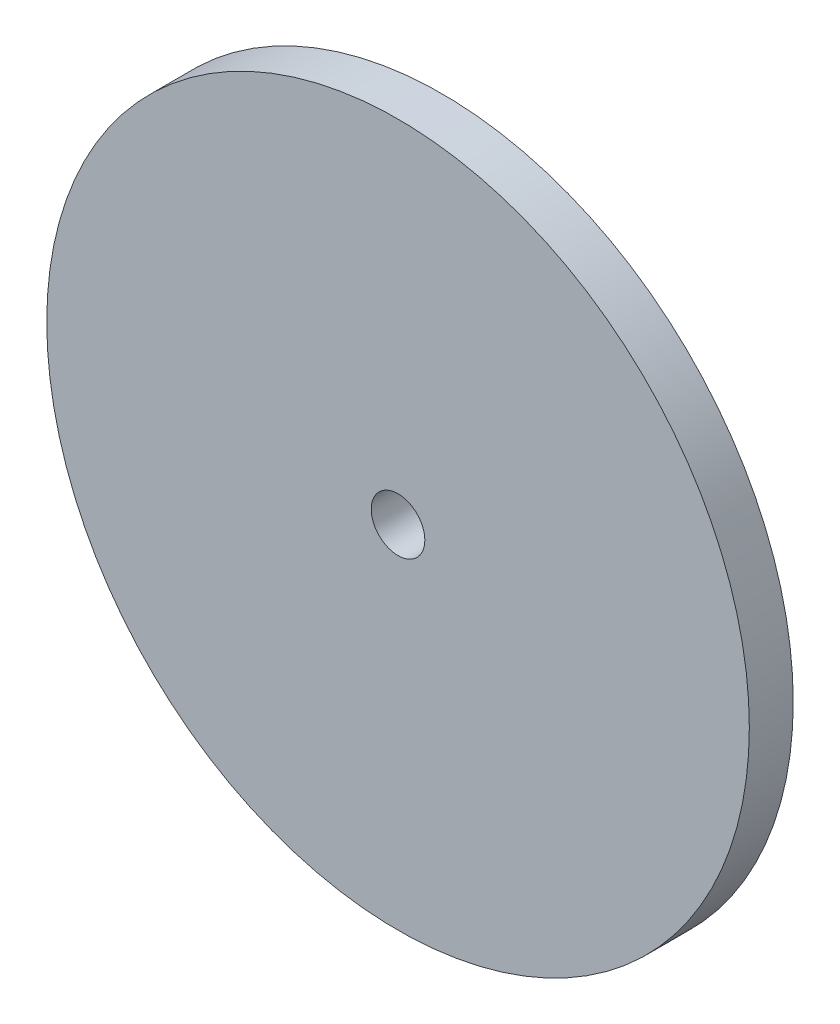
from build123d import *

# Parameters (mm, degrees)
SKETCH1_R           = 40
SKETCH1_R_2         = 3.05
BOSS_EXTRUDE1_DEPTH = 5


with BuildPart() as part:
    # Sketch1 → Boss-Extrude1 (new body)
    with BuildSketch(Plane.XY):
        Circle(SKETCH1_R)
        Circle(SKETCH1_R_2, mode=Mode.SUBTRACT)
    extrude(amount=BOSS_EXTRUDE1_DEPTH)


solid = part.part
